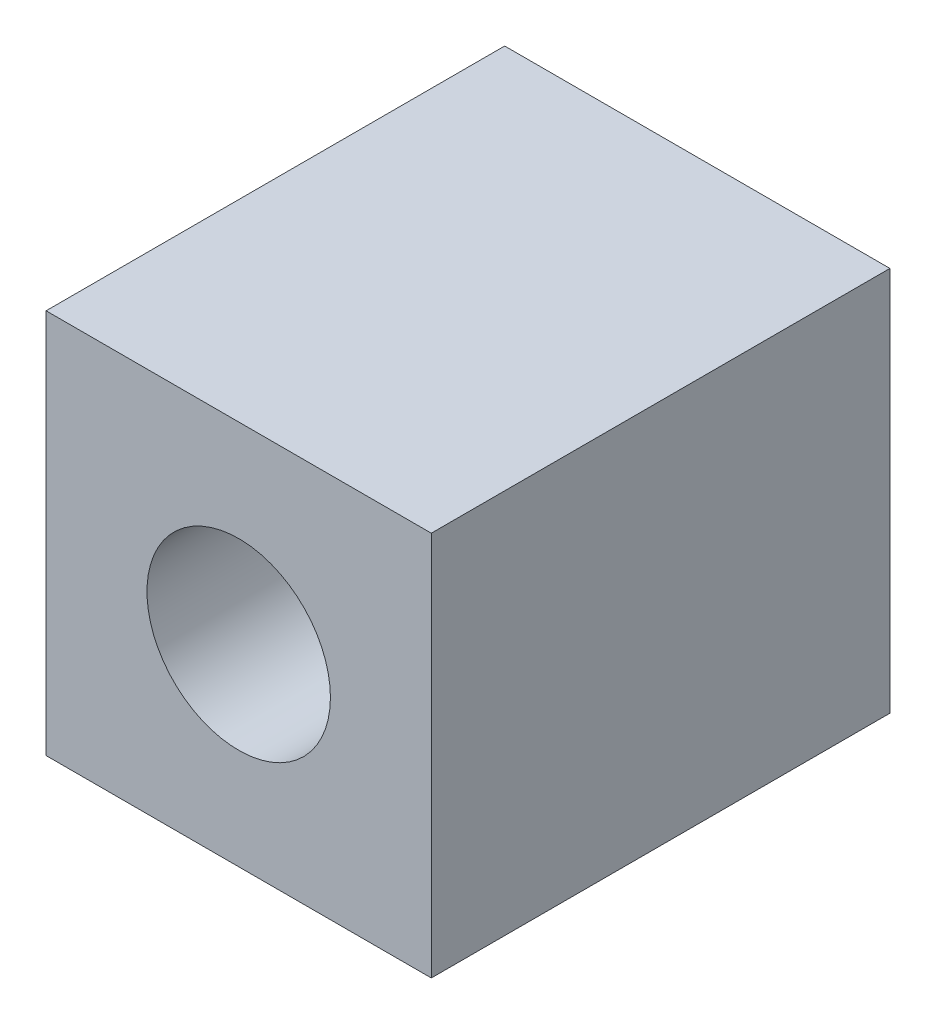
from build123d import *

# Parameters (mm, degrees)
ESQUISSE1_W             = 42
ESQUISSE1_H             = 42
BOSS_EXTRU_1_DEPTH      = 50
ESQUISSE2_R             = 10
ENL_V_MAT_EXTRU_1_DEPTH = 59.154965394


with BuildPart() as part:
    # Esquisse1 → Boss.-Extru.1 (new body)
    with BuildSketch(Plane.XY):
        Rectangle(ESQUISSE1_W, ESQUISSE1_H)
    extrude(amount=BOSS_EXTRU_1_DEPTH)

    # Esquisse2 → Enlèv. mat.-Extru.1 (cut, through all)
    with BuildSketch(Plane.XY.offset(50)):
        Circle(ESQUISSE2_R)
    extrude(amount=-ENL_V_MAT_EXTRU_1_DEPTH, mode=Mode.SUBTRACT)


solid = part.part
